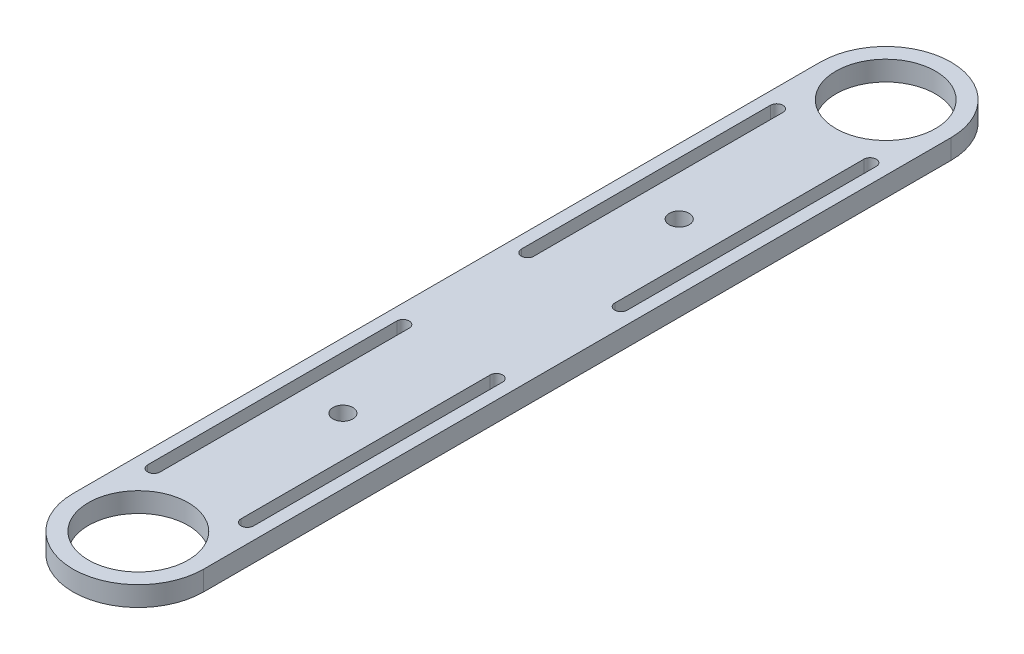
from build123d import *

# Parameters (mm, degrees)
BOSS_EXTRUDE1_DEPTH     = 3.175
CUT_EXTRUDE2_DEPTH      = 131.960225355
CUT_EXTRUDE2_DEPTH_BACK = 131.960225355
CUT_EXTRUDE3_DEPTH      = 131.960225355
CUT_EXTRUDE3_DEPTH_BACK = 131.960225355
SKETCH4_R               = 1.6
CUT_EXTRUDE4_DEPTH      = 131.960225355
CUT_EXTRUDE4_DEPTH_BACK = 131.960225355
SKETCH5_R               = 8


with BuildPart() as part:
    # Sketch1 → Boss-Extrude1 (new body)
    with BuildSketch(Plane(origin=(0, 0, 0), x_dir=(1, 0, 0), z_dir=(0, 1, 0))):
        with BuildLine():
            Line((-10.5, 0), (-10.5, -120))
            ThreePointArc((-10.5, -120), (0, -130.5), (10.5, -120))
            Line((10.5, -120), (10.5, 0))
            ThreePointArc((10.5, 0), (0, 10.5), (-10.5, 0))
        make_face()
    extrude(amount=BOSS_EXTRUDE1_DEPTH)

    # Sketch3 → Cut-Extrude2 (cut, two sides: drawn at the far end of the back side and taken through both)
    with BuildSketch(Plane.XZ.offset(-CUT_EXTRUDE2_DEPTH_BACK)):
        with BuildLine():
            Line((-8.5, 110), (-8.5, 70))
            ThreePointArc((-8.5, 70), (-7.5, 69), (-6.5, 70))
            Line((-6.5, 70), (-6.5, 110))
            ThreePointArc((-6.5, 110), (-7.5, 111), (-8.5, 110))
        make_face()
        with BuildLine():
            Line((6.5, 110), (6.5, 70))
            ThreePointArc((6.5, 70), (7.5, 69), (8.5, 70))
            Line((8.5, 70), (8.5, 110))
            ThreePointArc((8.5, 110), (7.5, 111), (6.5, 110))
        make_face()
        with BuildLine():
            Line((8.5, 10), (8.5, 50))
            ThreePointArc((8.5, 50), (7.5, 51), (6.5, 50))
            Line((6.5, 50), (6.5, 10))
            ThreePointArc((6.5, 10), (7.5, 9), (8.5, 10))
        make_face()
        with BuildLine():
            Line((-8.5, 50), (-8.5, 10))
            ThreePointArc((-8.5, 10), (-7.5, 9), (-6.5, 10))
            Line((-6.5, 10), (-6.5, 50))
            ThreePointArc((-6.5, 50), (-7.5, 51), (-8.5, 50))
        make_face()
    extrude(amount=CUT_EXTRUDE2_DEPTH + CUT_EXTRUDE2_DEPTH_BACK, mode=Mode.SUBTRACT)

    # Sketch4 → Cut-Extrude3 (cut, two sides: drawn at the far end of the back side and taken through both)
    with BuildSketch(Plane(origin=(0, 3.175, 0), x_dir=(1, 0, 0), z_dir=(0, 1, 0)).offset(-CUT_EXTRUDE3_DEPTH_BACK)):
        with Locations(Location((0, -33.15, 0), (0, 0, 270))):
            Circle(SKETCH4_R)
        with Locations(Location((0, -87.15, 0), (0, 0, 270))):
            Circle(SKETCH4_R)
    extrude(amount=CUT_EXTRUDE3_DEPTH + CUT_EXTRUDE3_DEPTH_BACK, mode=Mode.SUBTRACT)

    # Sketch5 → Cut-Extrude4 (cut, two sides: drawn at the far end of the back side and taken through both)
    with BuildSketch(Plane(origin=(0, 3.175, 0), x_dir=(1, 0, 0), z_dir=(0, 1, 0)).offset(-CUT_EXTRUDE4_DEPTH_BACK)):
        with Locations(Location((0, 0, 0), (0, 0, 270))):
            Circle(SKETCH5_R)
        with Locations(Location((0, -120, 0), (0, 0, 270))):
            Circle(SKETCH5_R)
    extrude(amount=CUT_EXTRUDE4_DEPTH + CUT_EXTRUDE4_DEPTH_BACK, mode=Mode.SUBTRACT)


solid = part.part
